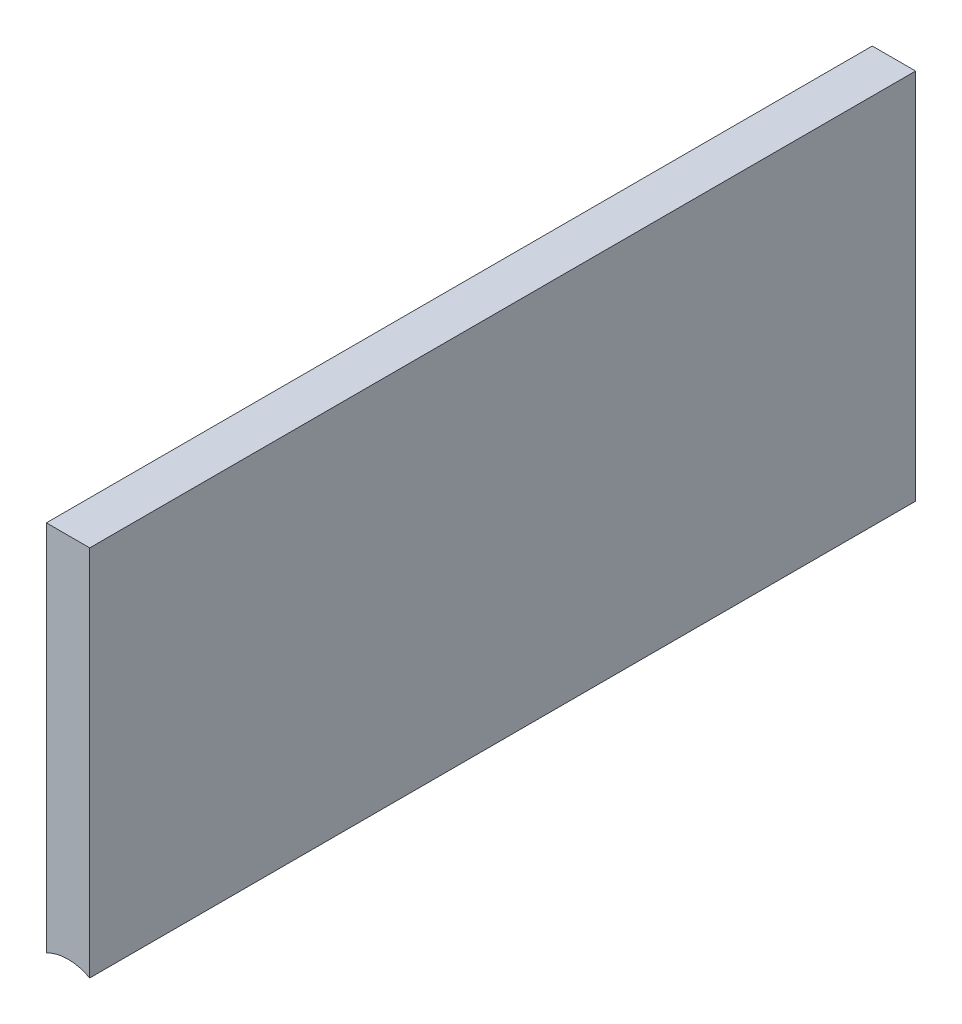
from build123d import *

# Parameters (mm, degrees)
CROQUIS1_W              = 57.15
CROQUIS1_H              = 25.4
SALIENTE_EXTRUIR1_DEPTH = 3
SALIENTE_EXTRUIR2_DEPTH = 57.15


with BuildPart() as part:
    # Croquis1 → Saliente-Extruir1 (new body)
    with BuildSketch(Plane(origin=(0, 0, 0), x_dir=(0, 0, -1), z_dir=(1, 0, 0))):
        with Locations((28.575, 12.7)):
            Rectangle(CROQUIS1_W, CROQUIS1_H)
    extrude(amount=SALIENTE_EXTRUIR1_DEPTH)

    # Croquis2 → Saliente-Extruir2 (add)
    with BuildSketch(Plane.XY):
        with BuildLine():
            Line((3, 0), (1.5, 0))
            ThreePointArc((1.5, 0), (2.273285807, -0.095608167), (3, -0.376674608))
            Line((3, -0.376674608), (3, 0))
        make_face()
        with BuildLine():
            Line((1.5, 0), (0, 0))
            Line((0, 0), (0, -0.376674608))
            ThreePointArc((0, -0.376674608), (0.726714193, -0.095608167), (1.5, 0))
        make_face()
    extrude(amount=-SALIENTE_EXTRUIR2_DEPTH)


solid = part.part
